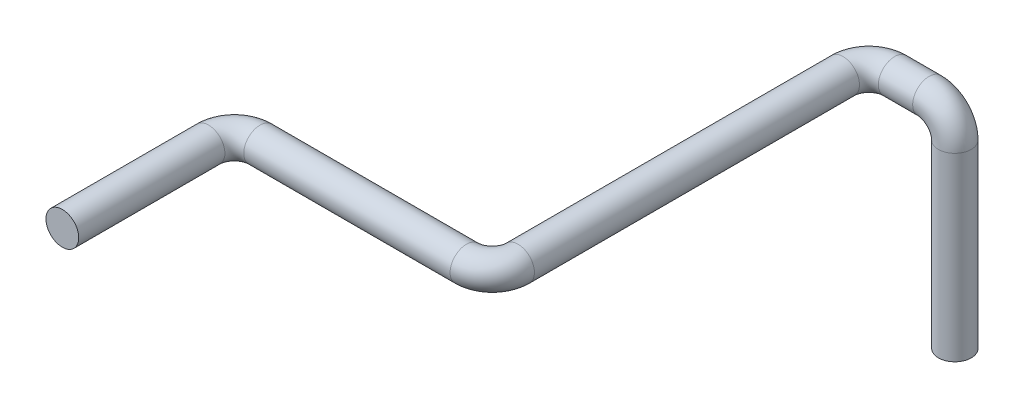
from build123d import *

# Parameters (mm, degrees)
CROQUIS1_R              = 9.525
SALIENTE_EXTRUIR1_DEPTH = 10
CROQUIS2_R              = 9.525


with BuildPart() as part:
    # Croquis1 → Saliente-Extruir1 (new body)
    with BuildSketch(Plane(origin=(0, 0, 0), x_dir=(1, 0, 0), z_dir=(0, 1, 0))):
        with Locations(Location((0, 0, 0), (0, 0, 270))):
            Circle(CROQUIS1_R)
    extrude(amount=SALIENTE_EXTRUIR1_DEPTH)

    # Barrer1: sweep along a curve in space
    with BuildLine() as barrer1_path:
        Line((0, 10, 0), (0, 105, 0))
        ThreePointArc((0, 105, 0), (-4.393398282, 115.606601718, 0), (-15, 120, 0))
        Line((-15, 120, 0), (-35, 120, 0))
        ThreePointArc((-35, 120, 0), (-45.606601718, 120, 4.393398282), (-50, 120, 15))
        Line((-50, 120, 15), (-50, 120, 204))
        ThreePointArc((-50, 120, 204), (-54.393398282, 120, 214.606601718), (-65, 120, 219))
        Line((-65, 120, 219), (-185, 120, 219))
        ThreePointArc((-185, 120, 219), (-195.606601718, 120, 223.393398282), (-200, 120, 234))
        Line((-200, 120, 234), (-200, 120, 319))
    # Croquis2 → Barrer1 (sweep)
    with BuildSketch(Plane(origin=(0, 10, 0), x_dir=(1, 0, 0), z_dir=(0, 1, 0))):
        Circle(CROQUIS2_R)
    sweep(path=barrer1_path.line)


solid = part.part
